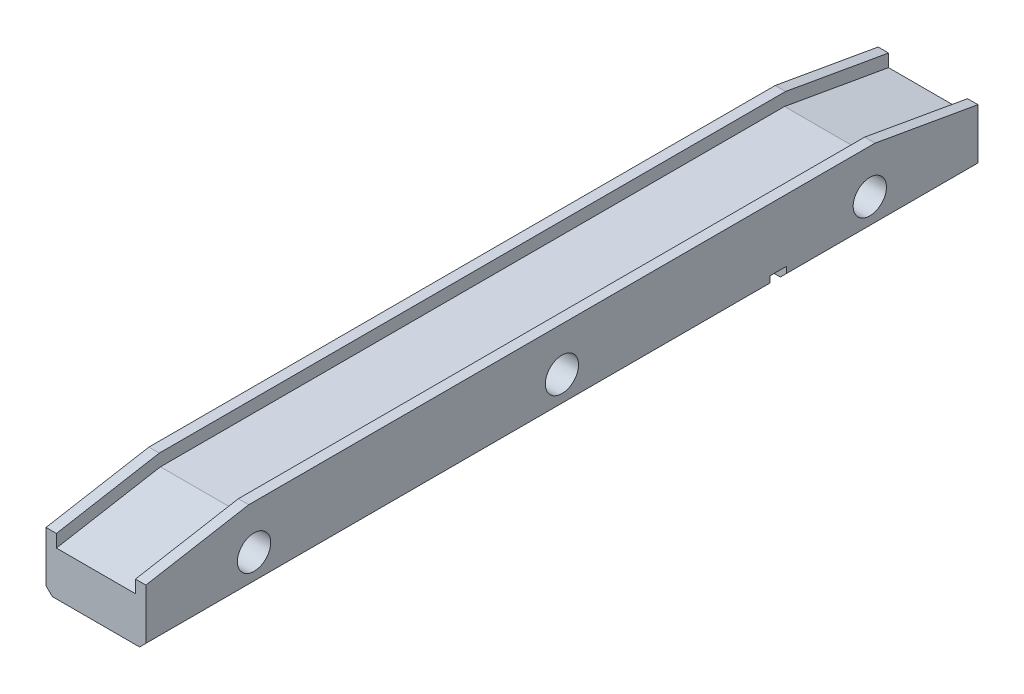
from build123d import *

# Parameters (mm, degrees)
RESSALTO_EXTRUS_O1_DEPTH = 178
ESBO_O2_R                = 8
CORTE_EXTRUS_O1_DEPTH    = 655
RESSALTO_EXTRUS_O2_DEPTH = 22
RESSALTO_EXTRUS_O3_DEPTH = 22
ESBO_O5_W                = 8
ESBO_O5_H                = 32.976988492
CORTE_EXTRUS_O2_DEPTH    = 89
CHANFRO1_SIZE            = 50
CHANFRO1_SIZE2           = 8.816349035
CORTE_EXTRUS_O3_DEPTH    = 108
CHANFRO2_SIZE            = 3
ESBO_O7_R                = 8
CORTE_EXTRUS_O4_DEPTH    = 89


with BuildPart() as part:
    # Esboço1 → Ressalto-extrusão1 (new, symmetric)
    with BuildSketch(Plane.XY):
        Polygon((-19, 0), (19, 0), (19, 6), (24, 6), (24, -30), (-24, -30), (-24, 6), (-19, 6), align=None)
    extrude(amount=RESSALTO_EXTRUS_O1_DEPTH, both=True)

    # Esboço2 → Corte-extrusão1 (cut)
    with BuildSketch(Plane(origin=(24, 0, 0), x_dir=(0, 0, -1), z_dir=(1, 0, 0))):
        with Locations(Location((-148, -15, 0), (0, 0, 90))):
            Circle(ESBO_O2_R)
        with Locations(Location((148, -15, 0), (0, 0, 90))):
            Circle(ESBO_O2_R)
    extrude(amount=-CORTE_EXTRUS_O1_DEPTH, mode=Mode.SUBTRACT)

    # Esboço3 → Ressalto-extrusão2 (add)
    with BuildSketch(Plane.XY.offset(178)):
        Polygon((-24, 6), (-24, -30), (24, -30), (24, 6), (19, 6), (19, 0), (-19, 0), (-19, 6), align=None)
    extrude(amount=RESSALTO_EXTRUS_O2_DEPTH)

    # Esboço4 → Ressalto-extrusão3 (add)
    with BuildSketch(Plane(origin=(0, 0, -178), x_dir=(-1, 0, 0), z_dir=(0, 0, -1))):
        Polygon((24, -30), (24, 6), (19, 6), (19, 0), (-19, 0), (-19, 6), (-24, 6), (-24, -30), align=None)
    extrude(amount=RESSALTO_EXTRUS_O3_DEPTH)

    # Esboço5 → Corte-extrusão2 (cut)
    with BuildSketch(Plane(origin=(24, 0, 0), x_dir=(0, 0, -1), z_dir=(1, 0, 0))):
        with Locations((104, -40.488494246)):
            Rectangle(ESBO_O5_W, ESBO_O5_H)
    extrude(amount=-CORTE_EXTRUS_O2_DEPTH, mode=Mode.SUBTRACT)

    # Chanfro1
    chanfro1_edges = [part.edges().sort_by_distance(p)[0] for p in [
        (0, 0, 200),
        (0, 0, -200),
    ]]
    chanfro1_side = [part.faces().sort_by_distance(p)[0] for p in [
        (0, 0, 0),
    ]]
    chamfer(chanfro1_edges, length=CHANFRO1_SIZE, length2=CHANFRO1_SIZE2, reference=chanfro1_side[0])

    # Esboço6 → Corte-extrusão3 (cut)
    with BuildSketch(Plane(origin=(24, 0, 0), x_dir=(0, 0, -1), z_dir=(1, 0, 0))):
        Polygon((-135.211980872, 8.700086435), (-200, 6), (-201.041889066, -2.907502517), align=None)
        Polygon((200, 6), (201.041889066, -2.907502517), (135.211980872, 8.700086435), align=None)
    extrude(amount=-CORTE_EXTRUS_O3_DEPTH, mode=Mode.SUBTRACT)

    # Chanfro2
    chanfro2_edges = [part.edges().sort_by_distance(p)[0] for p in [
        (24, -30, 50),
        (-24, -30, 50),
        (24, -30, -154),
        (-24, -30, -154),
    ]]
    chamfer(chanfro2_edges, length=CHANFRO2_SIZE)

    # Esboço7 → Corte-extrusão4 (cut)
    with BuildSketch(Plane(origin=(24, 0, 0), x_dir=(0, 0, -1), z_dir=(1, 0, 0))):
        with Locations(Location((0, -15, 0), (0, 0, 90))):
            Circle(ESBO_O7_R)
    extrude(amount=-CORTE_EXTRUS_O4_DEPTH, mode=Mode.SUBTRACT)


solid = part.part
